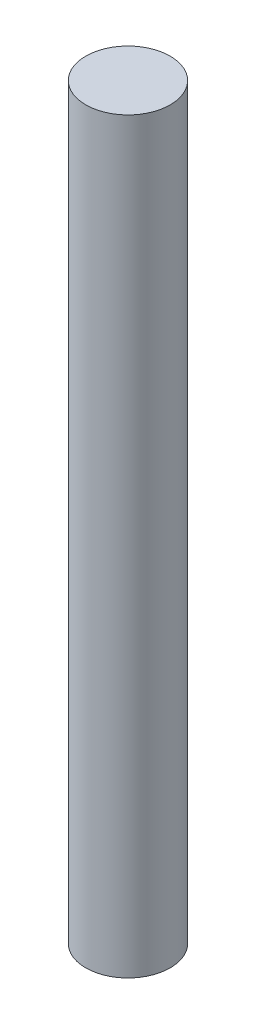
from build123d import *

# Parameters (mm, degrees)
CROQUIS1_R              = 4
SALIENTE_EXTRUIR1_DEPTH = 100
CROQUIS2_W              = 17.968690684
CROQUIS2_H              = 31.653106042
CORTAR_EXTRUIR1_DEPTH   = 23


with BuildPart() as part:
    # Croquis1 → Saliente-Extruir1 (new body)
    with BuildSketch(Plane(origin=(0, 0, 0), x_dir=(1, 0, 0), z_dir=(0, 1, 0))):
        with Locations(Location((0, 0, 0), (0, 0, 270))):
            Circle(CROQUIS1_R)
    extrude(amount=SALIENTE_EXTRUIR1_DEPTH)

    # Croquis2 → Cortar-Extruir1 (cut)
    with BuildSketch(Plane(origin=(-3.229670572, 0, -2.359921185), x_dir=(-0.5899802962006548, 0, 0.8074176429178321), z_dir=(-0.8074176429178321, 0, -0.5899802962006548))):
        with Locations((0.165622699, 13.369561391)):
            Rectangle(CROQUIS2_W, CROQUIS2_H)
    extrude(amount=-CORTAR_EXTRUIR1_DEPTH, mode=Mode.SUBTRACT)


solid = part.part
